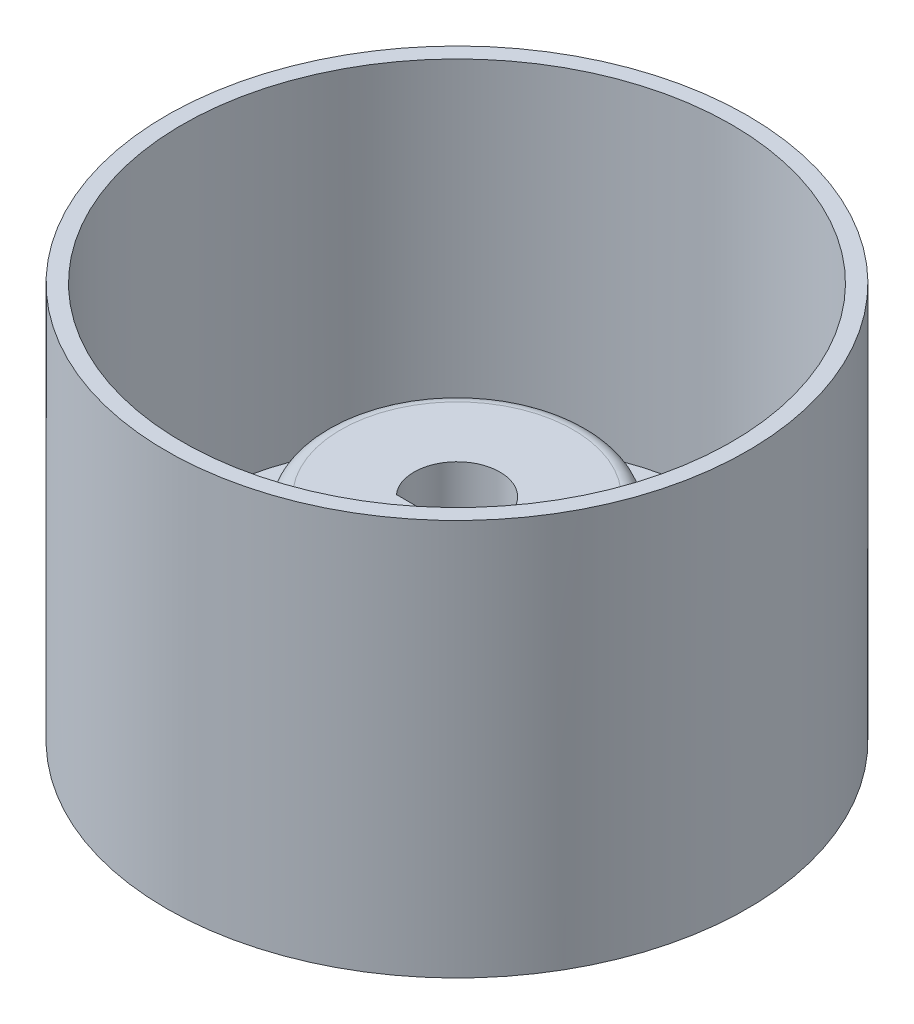
from build123d import *
from build123d.topology import SkipClean

# Parameters (mm, degrees)
SKETCH1_R           = 11
BOSS_EXTRUDE1_DEPTH = 2.5
SKETCH2_R           = 5
BOSS_EXTRUDE2_DEPTH = 5.5
SKETCH3_R           = 1.53
CUT_EXTRUDE1_DEPTH  = 17.5
CUT_EXTRUDE2_DEPTH  = 18.492855685
FILLET1_R           = 0.6
SKETCH5_R           = 11
SKETCH5_R_2         = 10.4
BOSS_EXTRUDE3_DEPTH = 15


with BuildPart() as part:
    # Sketch1 → Boss-Extrude1 (new body)
    with BuildSketch(Plane(origin=(0, 0, 0), x_dir=(1, 0, 0), z_dir=(0, 1, 0))):
        with Locations(Location((0, 0, 0), (0, 0, 270))):
            Circle(SKETCH1_R)
    extrude(amount=BOSS_EXTRUDE1_DEPTH)

    # Sketch2 → Boss-Extrude2 (add)
    with BuildSketch(Plane(origin=(0, 2.5, 0), x_dir=(1, 0, 0), z_dir=(0, 1, 0))):
        with Locations(Location((0, 0, 0), (0, 0, 270))):
            Circle(SKETCH2_R)
    extrude(amount=BOSS_EXTRUDE2_DEPTH)

    # Sketch3 → Cut-Extrude1 (cut, through all)
    with BuildSketch(Plane(origin=(0, 2.5, 0), x_dir=(1, 0, 0), z_dir=(0, 1, 0))):
        with Locations(Location((0, 8, 0), (0, 0, 270))):
            Circle(SKETCH3_R)
        with Locations(Location((6.92820323, -4, 0), (0, 0, 270))):
            Circle(SKETCH3_R)
        with Locations(Location((-6.92820323, -4, 0), (0, 0, 270))):
            Circle(SKETCH3_R)
    extrude(amount=-CUT_EXTRUDE1_DEPTH, mode=Mode.SUBTRACT)

    # Sketch4 → Cut-Extrude2 (cut, through all)
    with BuildSketch(Plane(origin=(0, 8, 0), x_dir=(1, 0, 0), z_dir=(0, 1, 0))):
        with BuildLine():
            Line((-1.218605761, -1.075), (1.218605761, -1.075))
            ThreePointArc((1.218605761, -1.075), (0, 1.625), (-1.218605761, -1.075))
        make_face()
    extrude(amount=-CUT_EXTRUDE2_DEPTH, mode=Mode.SUBTRACT)

    # Fillet1
    fillet1_edges = [part.edges().sort_by_distance(p)[0] for p in [
        (0, 2.5, -5),
        (0, 8, -5),
    ]]
    fillet(fillet1_edges, radius=FILLET1_R)

    # Sketch5 → Boss-Extrude3 (add)
    with SkipClean():  # the faces are left unmerged after this step: merging them gives an invalid solid
        with BuildSketch(Plane.XZ):
            with Locations(Location((0, 0, 0), (0, 0, 270))):
                Circle(SKETCH5_R)
            with Locations(Location((0, 0, 0), (0, 0, 270))):
                Circle(SKETCH5_R_2, mode=Mode.SUBTRACT)
        extrude(amount=-BOSS_EXTRUDE3_DEPTH)


solid = part.part
